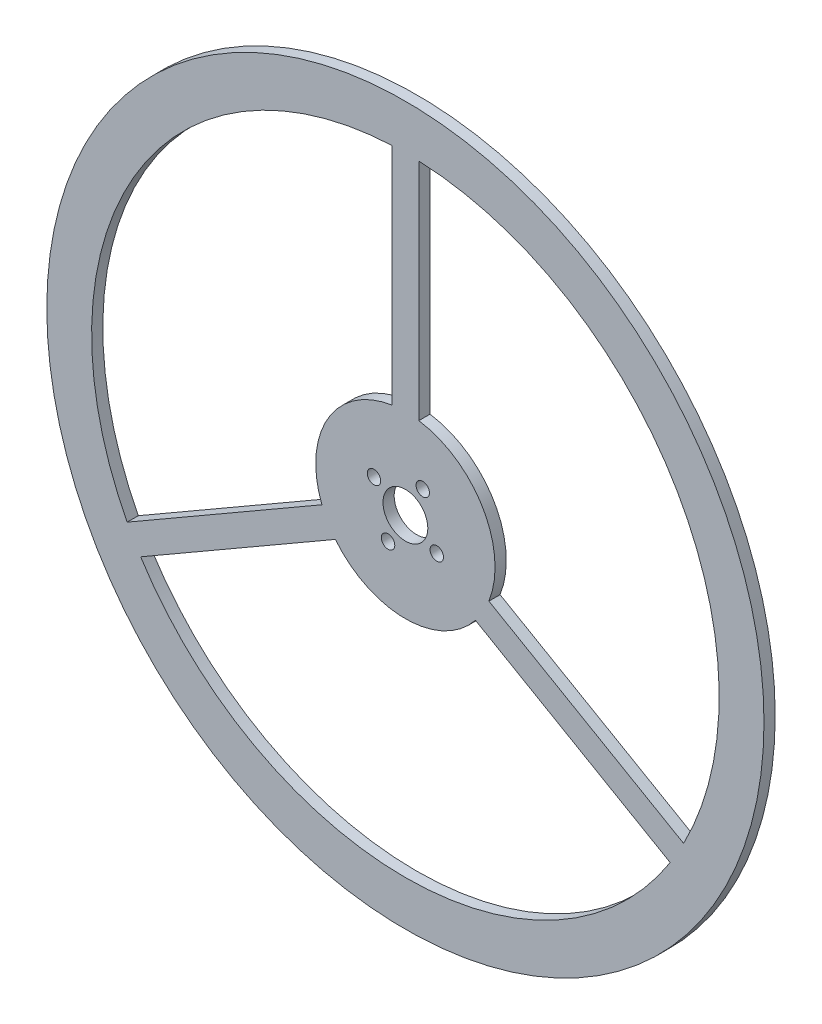
from build123d import *

# Parameters (mm, degrees)
SKETCH_1_R          = 80
SKETCH_1_R_2        = 5
EXTRUDE_1_DEPTH     = 2.5
SKETCH_2_R          = 1.5
CUT_EXTRUDE_1_DEPTH = 114.164702978


with BuildPart() as part:
    # 草图1 → 凸台-拉伸1 (new body)
    with BuildSketch(Plane.XY):
        Circle(SKETCH_1_R)
        Circle(SKETCH_1_R_2, mode=Mode.SUBTRACT)
        with BuildLine():
            Line((-3, 19.773719933), (-3, 69.93568474))
            ThreePointArc((-3, 69.93568474), (-60.621778265, 35), (-62.066079616, -32.369766158))
            Line((-62.066079616, -32.369766158), (-18.62454379, -7.288783755))
            ThreePointArc((-18.62454379, -7.288783755), (-17.320508076, 10), (-3, 19.773719933))
        make_face(mode=Mode.SUBTRACT)
        with BuildLine():
            Line((3, 19.773719933), (3, 69.93568474))
            ThreePointArc((3, 69.93568474), (60.621778265, 35), (62.066079616, -32.369766158))
            Line((62.066079616, -32.369766158), (18.62454379, -7.288783755))
            ThreePointArc((18.62454379, -7.288783755), (17.320508076, 10), (3, 19.773719933))
        make_face(mode=Mode.SUBTRACT)
        with BuildLine():
            Line((15.62454379, -12.484936178), (59.066079616, -37.565918581))
            ThreePointArc((59.066079616, -37.565918581), (0, -70), (-59.066079616, -37.565918581))
            Line((-59.066079616, -37.565918581), (-15.62454379, -12.484936178))
            ThreePointArc((-15.62454379, -12.484936178), (0, -20), (15.62454379, -12.484936178))
        make_face(mode=Mode.SUBTRACT)
    extrude(amount=EXTRUDE_1_DEPTH)

    # 草图2 → 切除-拉伸1 (cut, through all)
    with BuildSketch(Plane(origin=(0, 0, 0), x_dir=(-1, 0, 0), z_dir=(0, 0, -1))):
        with Locations((-7.000881354, -3.871389966)):
            Circle(SKETCH_2_R)
        with Locations((-3.871389966, 7.000881354)):
            Circle(SKETCH_2_R)
        with Locations((7.000881354, 3.871389966)):
            Circle(SKETCH_2_R)
        with Locations((3.871389966, -7.000881354)):
            Circle(SKETCH_2_R)
    extrude(amount=-CUT_EXTRUDE_1_DEPTH, mode=Mode.SUBTRACT)


solid = part.part
